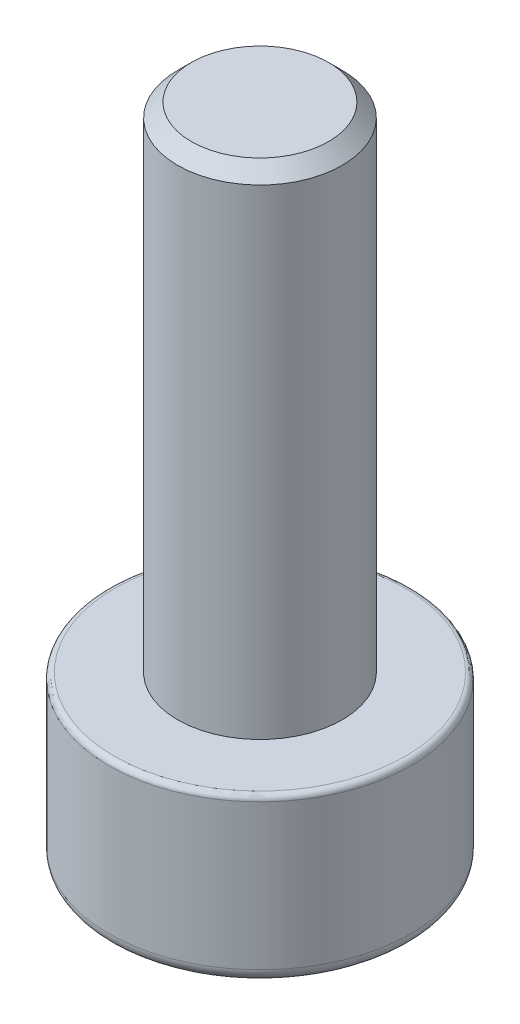
from build123d import *

# Parameters (mm, degrees)
SKETCH1_R           = 2.75
BOSS_EXTRUDE1_DEPTH = 3
SKETCH2_R           = 1.5
BOSS_EXTRUDE2_DEPTH = 9
CUT_EXTRUDE1_DEPTH  = 1.5
CHAMFER1_SIZE       = 0.25
FILLET1_R           = 0.25
CHAMFER2_SIZE       = 0.25
FILLET2_R           = 0.1


with BuildPart() as part:
    # Sketch1 → Boss-Extrude1 (new body)
    with BuildSketch(Plane(origin=(0, 0, 0), x_dir=(1, 0, 0), z_dir=(0, 1, 0))):
        with Locations(Location((0, 0, 0), (0, 0, 270))):
            Circle(SKETCH1_R)
    extrude(amount=BOSS_EXTRUDE1_DEPTH)

    # Sketch2 → Boss-Extrude2 (add)
    with BuildSketch(Plane(origin=(0, 3, 0), x_dir=(1, 0, 0), z_dir=(0, 1, 0))):
        with Locations(Location((0, 0, 0), (0, 0, 270))):
            Circle(SKETCH2_R)
    extrude(amount=BOSS_EXTRUDE2_DEPTH)

    # Sketch3 → Cut-Extrude1 (cut)
    with BuildSketch(Plane.XZ):
        Polygon((0.934168857, 0.974591477), (-0.376936549, 1.2963097), (-1.311105406, 0.321718223), (-0.934168857, -0.974591477), (0.376936549, -1.2963097), (1.311105406, -0.321718223), align=None)
    extrude(amount=-CUT_EXTRUDE1_DEPTH, mode=Mode.SUBTRACT)

    # Chamfer1
    chamfer1_edges = [part.edges().sort_by_distance(p)[0] for p in [
        (1.122637131, 0, 0.326436627),
        (0.278616154, 0, 1.135450588),
        (-0.844020977, 0, 0.809013962),
        (-1.122637131, 0, -0.326436627),
        (-0.278616154, 0, -1.135450588),
        (0.844020977, 0, -0.809013962),
    ]]
    chamfer(chamfer1_edges, length=CHAMFER1_SIZE)

    # Fillet1
    fillet1_edges = [part.edges().sort_by_distance(p)[0] for p in [
        (0, 0, -2.75),
    ]]
    fillet(fillet1_edges, radius=FILLET1_R)

    # Chamfer2
    chamfer2_edges = [part.edges().sort_by_distance(p)[0] for p in [
        (0, 12, -1.5),
    ]]
    chamfer(chamfer2_edges, length=CHAMFER2_SIZE)

    # Fillet2
    fillet2_edges = [part.edges().sort_by_distance(p)[0] for p in [
        (0, 3, -2.75),
    ]]
    fillet(fillet2_edges, radius=FILLET2_R)


solid = part.part
